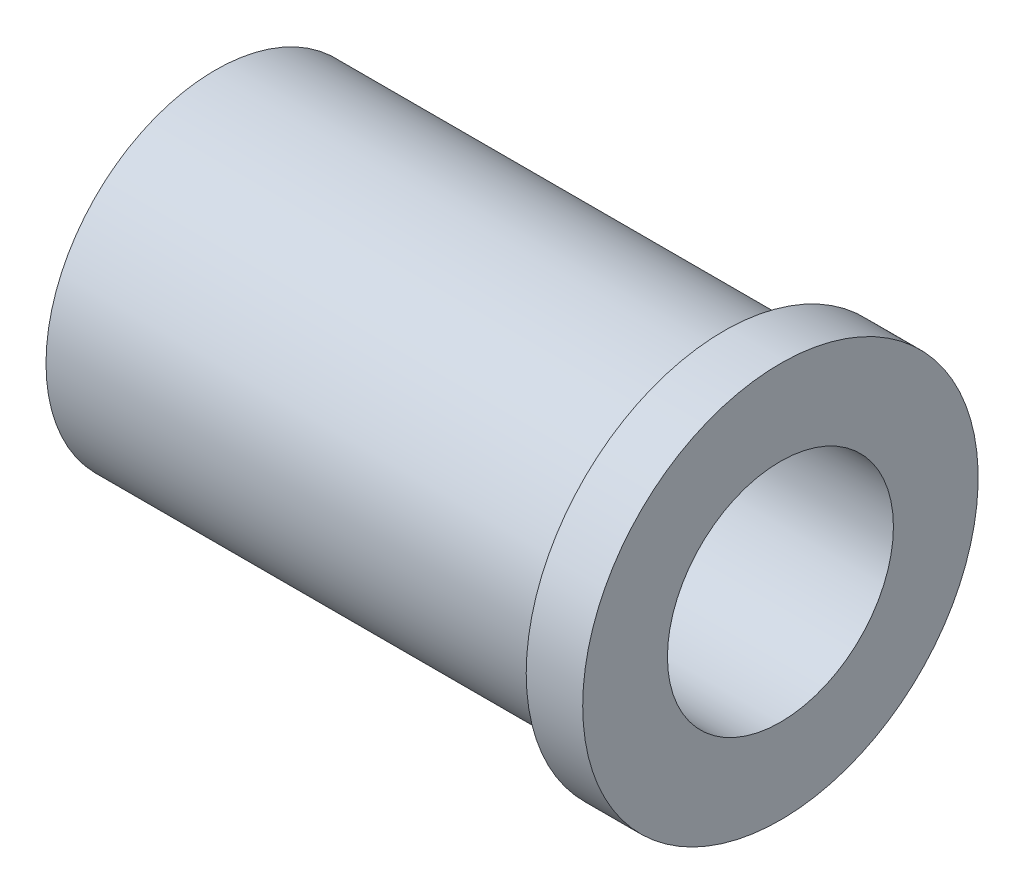
from build123d import *

# Parameters (mm, degrees)
FILLET1_R = 4


with BuildPart() as part:
    # Sketch1 → Revolve1 (revolve)
    with BuildSketch(Plane.XY, mode=Mode.PRIVATE) as revolve1_sk:
        Polygon((0, 20), (100, 20), (100, 30), (100, 35), (90, 35), (90, 30), (0, 30), align=None)
    revolve(revolve1_sk.sketch.rotate(Axis((0, 0, 0), (1, 0, 0)), 90), axis=Axis((0, 0, 0), (1, 0, 0)))

    # Fillet1
    fillet1_edges = [part.edges().sort_by_distance(p)[0] for p in [
        (0, 0, -20),
    ]]
    fillet(fillet1_edges, radius=FILLET1_R)


solid = part.part
